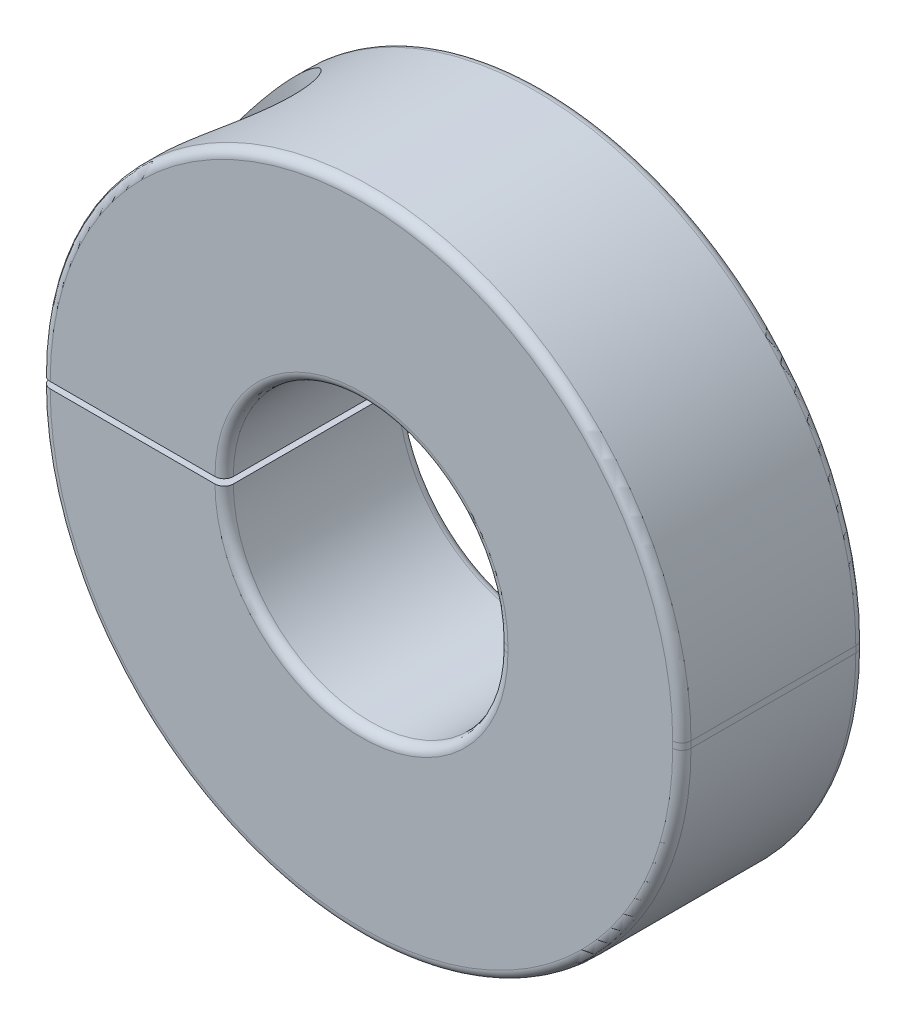
from build123d import *

# Parameters (mm, degrees)
EXTRUDE1_DEPTH     = 6.35
CUT_EXTRUDE2_DEPTH = 3.175
FILLET1_R          = 0.635
CHAMFER2_SIZE      = 0.254


with BuildPart() as part:
    # Sketch1 → Extrude1 (new, symmetric)
    with BuildSketch(Plane.XY):
        with BuildLine():
            Line((-22.225, 0.22225), (-9.525, 0.22225))
            ThreePointArc((-9.525, 0.22225), (0, 9.74725), (9.525, 0.22225))
            Line((9.525, 0.22225), (9.525, -0.22225))
            ThreePointArc((9.525, -0.22225), (0, -9.74725), (-9.525, -0.22225))
            Line((-9.525, -0.22225), (-22.225, -0.22225))
            ThreePointArc((-22.225, -0.22225), (0, -22.44725), (22.225, -0.22225))
            Line((22.225, -0.22225), (22.225, 0.22225))
            ThreePointArc((22.225, 0.22225), (0, 22.44725), (-22.225, 0.22225))
        make_face()
    extrude(amount=EXTRUDE1_DEPTH, both=True)

    # Sketch4 → Cut-Revolve1 (revolve, cut)
    with BuildSketch(Plane.XY, mode=Mode.PRIVATE) as cut_revolve1_sk:
        Polygon((-15.875, 22.44725), (-11.1125, 22.44725), (-11.1125, 3.39725), (-12.7, 3.39725), (-12.7, -22.44725), (-15.875, -22.44725), align=None)
    revolve(cut_revolve1_sk.sketch.rotate(Axis((-15.875, -22.44725, 0), (0, 1, 0)), 90), axis=Axis((-15.875, -22.44725, 0), (0, 1, 0)), mode=Mode.SUBTRACT)

    # Fillet1
    fillet1_edges = [part.edges().sort_by_distance(p)[0] for p in [
        (0, 9.74725, 6.35),
        (9.525, 0, 6.35),
        (0, -9.74725, 6.35),
        (0, -22.44725, 6.35),
        (22.225, 0, 6.35),
        (0, 22.44725, 6.35),
        (22.225, 0, -6.35),
        (0, -22.44725, -6.35),
        (0, -9.74725, -6.35),
        (9.525, 0, -6.35),
        (0, 9.74725, -6.35),
        (0, 22.44725, -6.35),
    ]]
    fillet(fillet1_edges, radius=FILLET1_R)


with BuildPart() as body_2:
    # Sketch6 → Revolve1 (revolve)
    with BuildSketch(Plane.XY, mode=Mode.PRIVATE) as revolve1_sk:
        Polygon((-15.875, 9.74725), (-11.1125, 9.74725), (-11.1125, 3.39725), (-12.7, 3.39725), (-12.7, -9.30275), (-15.875, -9.30275), align=None)
    revolve(revolve1_sk.sketch.rotate(Axis((-15.875, -9.30275, 0), (0, 1, 0)), 90), axis=Axis((-15.875, -9.30275, 0), (0, 1, 0)))

    # Sketch7 → Cut-Extrude2 (cut)
    with BuildSketch(Plane(origin=(0, 9.74725, 0), x_dir=(-1, 0, 0), z_dir=(0, 1, 0))):
        Polygon((15.875, -2.932939367), (18.415, -1.466469684), (18.415, 1.466469684), (15.875, 2.932939367), (13.335, 1.466469684), (13.335, -1.466469684), align=None)
    extrude(amount=-CUT_EXTRUDE2_DEPTH, mode=Mode.SUBTRACT)

    # Chamfer2
    chamfer2_edges = [body_2.edges().sort_by_distance(p)[0] for p in [
        (-15.875, 9.74725, 4.7625),
    ]]
    chamfer(chamfer2_edges, length=CHAMFER2_SIZE)


solid = Compound([part.part, body_2.part])
